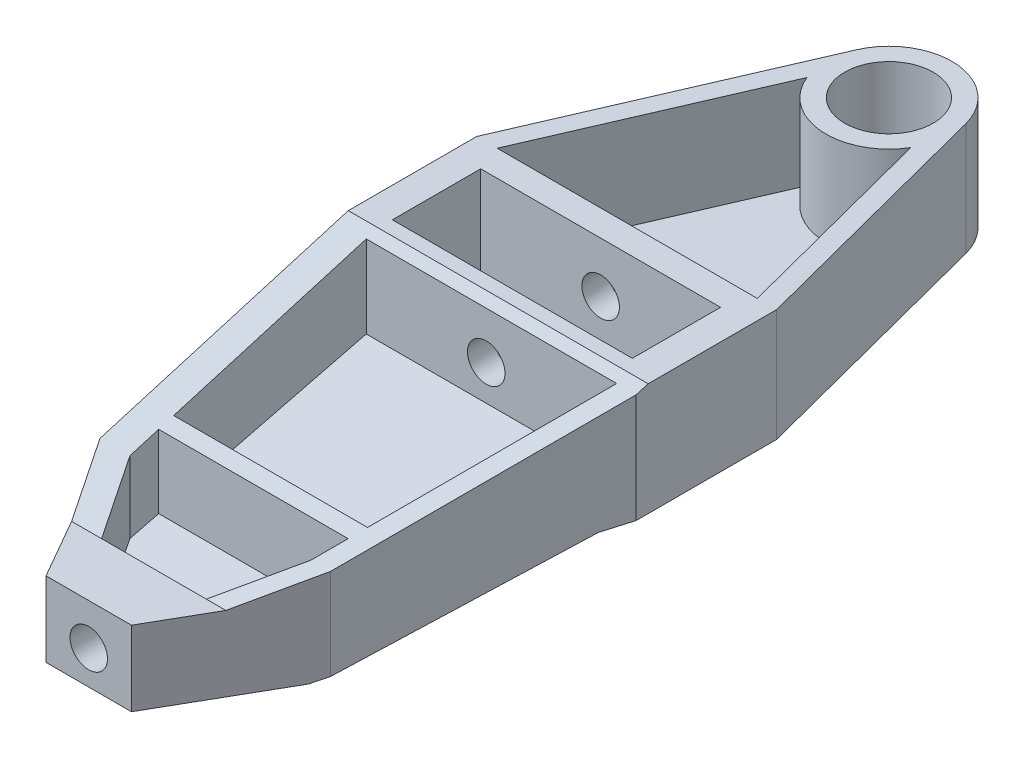
from build123d import *

# Parameters (mm, degrees)
SKETCH1_R                      = 15
SKETCH1_W                      = 81.28
SKETCH1_H                      = 29.9212
BOSS_EXTRUDE1_DEPTH            = 88.9
CUT_EXTRUDE1_DEPTH             = 894.223960082
CUT_EXTRUDE1_DEPTH_BACK        = 894.223960082
CUT_EXTRUDE2_REACH             = 2404.418
CUT_EXTRUDE2_DIRECTION_2_DEPTH = 2403.418387278
CUT_EXTRUDE3_DEPTH             = 2403.418387278
CUT_EXTRUDE3_DEPTH_BACK        = 31.75
SKETCH6_R                      = 6.35
CUT_EXTRUDE4_DEPTH             = 31.75
SKETCH7_R                      = 6.35
CUT_EXTRUDE5_DEPTH             = 50.8


with BuildPart() as part:
    # Sketch1 → Boss-Extrude1 (new body)
    with BuildSketch(Plane(origin=(0, 718.612000035, 0), x_dir=(1, 0, 0), z_dir=(0, 1, 0))):
        with BuildLine():
            Line((2295.073740346, -527.28515435), (2266.117740346, -527.28515435))
            Line((2266.117740346, -527.28515435), (2241.551712769, -484.433115091))
            Line((2241.551712769, -484.433115091), (2241.551712769, -356.772715091))
            Line((2241.551712769, -356.772715091), (2280.410248463, -267.100940225))
            ThreePointArc((2280.410248463, -267.100940225), (2301.649946984, -254.303850194), (2320.663918503, -270.221111063))
            Line((2320.663918503, -270.221111063), (2343.151712769, -356.772715091))
            Line((2343.151712769, -356.772715091), (2343.151712769, -404.372315091))
            Line((2343.151712769, -404.372315091), (2319.639767922, -484.433115091))
            Line((2319.639767922, -484.433115091), (2295.073740346, -527.28515435))
        make_face()
        with Locations(Location((2299.99999994, -275.59, 0), (0, 0, 270))):
            Circle(SKETCH1_R, mode=Mode.SUBTRACT)
        with Locations((2292.351712769, -380.572515091)):
            Rectangle(SKETCH1_W, SKETCH1_H, mode=Mode.SUBTRACT)
    extrude(amount=-BOSS_EXTRUDE1_DEPTH)

    # Sketch3 → Cut-Extrude1 (cut, two sides: drawn at the far end of the back side and taken through both)
    with BuildSketch(Plane(origin=(2299.99999994, 0, 0), x_dir=(0, 0, -1), z_dir=(1, 0, 0)).offset(-CUT_EXTRUDE1_DEPTH_BACK)):
        Polygon((-254.240000028, 680.512000035), (-414.278315091, 680.512000035), (-489.18515435, 661.827103465), (-527.28515435, 661.827103465), (-527.28515435, 629.712000035), (-254.240000028, 629.712000035), align=None)
        Polygon((-527.28515435, 687.227103465), (-527.28515435, 718.612000035), (-400.308315091, 718.612000035), (-506.96515435, 687.227103465), align=None)
    extrude(amount=CUT_EXTRUDE1_DEPTH + CUT_EXTRUDE1_DEPTH_BACK, mode=Mode.SUBTRACT)

    # Cut-Extrude2: up to this plane
    cut_extrude2_end = Plane(origin=(2241.551712769, 686.673213286, 415.815179194), z_dir=(0, 0.9702698033545601, 0.24202584303810049))
    # Sketch4 → Cut-Extrude2 (cut, up to the surface)
    with BuildSketch(Plane(origin=(0, 718.612000035, 0), x_dir=(1, 0, 0), z_dir=(0, 1, 0)), mode=Mode.PRIVATE) as cut_extrude2_sk1:
        Polygon((2317.374261561, -469.611817535), (2336.533545297, -404.372315091), (2251.711712769, -404.372315091), (2251.711712769, -469.611817535), align=None)
    cut_extrude2_tool1 = split(extrude(cut_extrude2_sk1.sketch, amount=-CUT_EXTRUDE2_REACH, mode=Mode.PRIVATE), bisect_by=cut_extrude2_end, keep=Keep.BOTH, mode=Mode.PRIVATE)
    add(cut_extrude2_tool1.solids().sort_by_distance((2289.536084, 718.612, 435.607712))[0], mode=Mode.SUBTRACT)
    # Sketch4 → Cut-Extrude2 (cut, up to the surface)
    with BuildSketch(Plane(origin=(0, 718.612000035, 0), x_dir=(1, 0, 0), z_dir=(0, 1, 0)), mode=Mode.PRIVATE) as cut_extrude2_sk2:
        Polygon((2313.02160045, -484.433115091), (2315.882386888, -474.691817535), (2251.711712769, -474.691817535), (2251.711712769, -484.433115091), (2264.6287806, -506.96515435), (2300.104532619, -506.96515435), align=None)
    cut_extrude2_tool2 = split(extrude(cut_extrude2_sk2.sketch, amount=-CUT_EXTRUDE2_REACH, mode=Mode.PRIVATE), bisect_by=cut_extrude2_end, keep=Keep.BOTH, mode=Mode.PRIVATE)
    add(cut_extrude2_tool2.solids().sort_by_distance((2282.625495, 718.612, 489.24748))[0], mode=Mode.SUBTRACT)

    # Sketch4 → Cut-Extrude2 direction 2 (cut)
    with BuildSketch(Plane(origin=(0, 718.612000035, 0), x_dir=(1, 0, 0), z_dir=(0, 1, 0))):
        Polygon((2317.374261561, -469.611817535), (2336.533545297, -404.372315091), (2251.711712769, -404.372315091), (2251.711712769, -469.611817535), align=None)
        Polygon((2313.02160045, -484.433115091), (2315.882386888, -474.691817535), (2251.711712769, -474.691817535), (2251.711712769, -484.433115091), (2264.6287806, -506.96515435), (2300.104532619, -506.96515435), align=None)
    extrude(amount=CUT_EXTRUDE2_DIRECTION_2_DEPTH, mode=Mode.SUBTRACT)

    # Sketch5 → Cut-Extrude3 (cut, two sides: drawn at the far end of the back side and taken through both)
    with BuildSketch(Plane(origin=(0, 718.612000035, 0), x_dir=(1, 0, 0), z_dir=(0, 1, 0)).offset(-CUT_EXTRUDE3_DEPTH_BACK)):
        with BuildLine():
            Line((2336.590880718, -356.772715091), (2318.338523091, -286.522569115))
            ThreePointArc((2318.338523091, -286.522569115), (2298.350052896, -296.876149806), (2280.195820512, -283.566025074))
            Line((2280.195820512, -283.566025074), (2248.472295676, -356.772715091))
            Line((2248.472295676, -356.772715091), (2336.590880718, -356.772715091))
        make_face()
    extrude(amount=CUT_EXTRUDE3_DEPTH + CUT_EXTRUDE3_DEPTH_BACK, mode=Mode.SUBTRACT)

    # Sketch6 → Cut-Extrude4 (cut)
    with BuildSketch(Plane.XY.offset(527.28515435)):
        with Locations((2280.595740346, 673.257103465)):
            Circle(SKETCH6_R)
    extrude(amount=-CUT_EXTRUDE4_DEPTH, mode=Mode.SUBTRACT)

    # Sketch7 → Cut-Extrude5 (cut)
    with BuildSketch(Plane.XY.offset(404.372315091)):
        with Locations((2292.351712769, 701.469420385)):
            Circle(SKETCH7_R)
    extrude(amount=-CUT_EXTRUDE5_DEPTH, mode=Mode.SUBTRACT)


solid = part.part
